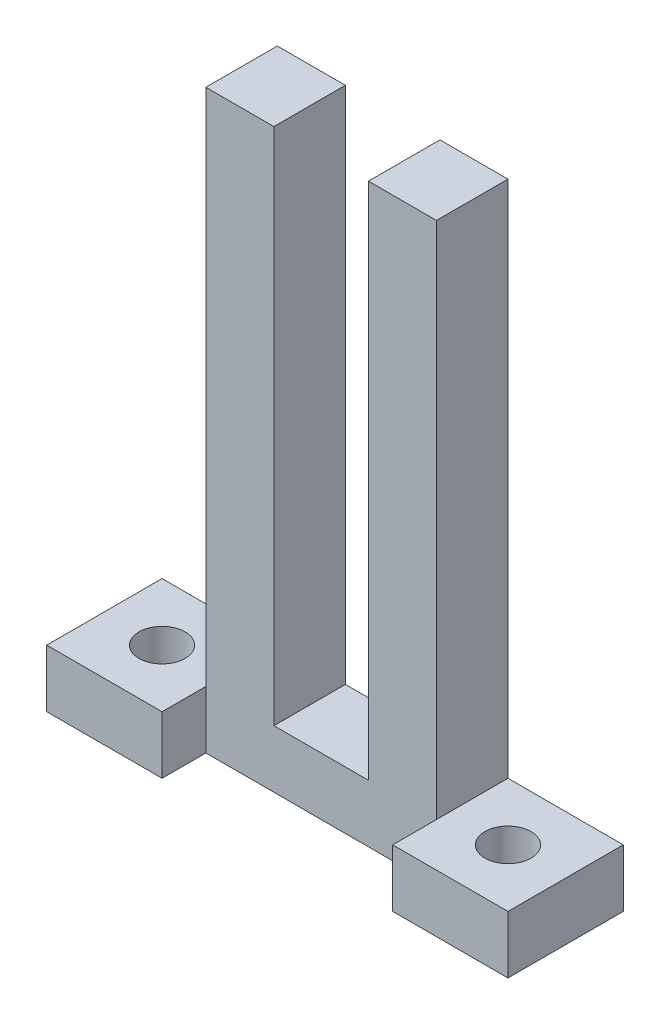
from build123d import *

# Parameters (mm, degrees)
SKETCH_2_W          = 5.9
SKETCH_2_H          = 6.2
EXTRUDE_1_DEPTH     = 50
EXTRUDE_1_2_DEPTH   = 50
SKETCH_3_W          = 40
SKETCH_3_H          = 6.2
EXTRUDE_2_DEPTH     = 5
SKETCH_4_W          = 10
SKETCH_4_H          = 5
EXTRUDE_3_DEPTH     = 3.8
CUT_EXTRUDE_4_REACH = 56.437
SKETCH_5_R          = 2


with BuildPart() as part:
    # Эскиз2 → Вытянуть1 (new body)
    with BuildSketch(Plane(origin=(0, 0, 0), x_dir=(1, 0, 0), z_dir=(0, 1, 0))):
        with Locations((2.95, 3.1)):
            Rectangle(SKETCH_2_W, SKETCH_2_H)
    extrude(amount=EXTRUDE_1_DEPTH)



with BuildPart() as body_2:
    # Эскиз2 → Extrude 1 2 (new body)
    with BuildSketch(Plane(origin=(0, 0, 0), x_dir=(1, 0, 0), z_dir=(0, 1, 0))):
        with Locations((17.05, 3.1)):
            Rectangle(SKETCH_2_W, SKETCH_2_H)
    extrude(amount=EXTRUDE_1_2_DEPTH)


with BuildPart() as part_1:
    add(part.part)

    add(body_2.part)  # Вытянуть2 merges body 2
    # Эскиз3 → Вытянуть2 (add)
    with BuildSketch(Plane(origin=(0, 0, 0), x_dir=(1, 0, 0), z_dir=(0, 1, 0))):
        with Locations((10, 3.1)):
            Rectangle(SKETCH_3_W, SKETCH_3_H)
    extrude(amount=EXTRUDE_2_DEPTH)

    # Эскиз4 → Вытянуть3 (add)
    with BuildSketch(Plane.XY):
        with Locations((-5, 2.5)):
            Rectangle(SKETCH_4_W, SKETCH_4_H)
        with Locations((25, 2.5)):
            Rectangle(SKETCH_4_W, SKETCH_4_H)
    extrude(amount=EXTRUDE_3_DEPTH)

    # Эскиз5 → Вытянуть4 (cut, up to next)
    with BuildSketch(Plane(origin=(0, 5, 0), x_dir=(1, 0, 0), z_dir=(0, 1, 0)), mode=Mode.PRIVATE) as cut_extrude_4_sk1:
        with Locations(Location((25, 1.2, 0), (0, 0, 270))):
            Circle(SKETCH_5_R)
    cut_extrude_4_tool1 = extrude(cut_extrude_4_sk1.sketch, amount=-CUT_EXTRUDE_4_REACH, mode=Mode.PRIVATE) & part_1.part
    # Эскиз5 → Вытянуть4 (cut, up to next)
    with BuildSketch(Plane(origin=(0, 5, 0), x_dir=(1, 0, 0), z_dir=(0, 1, 0)), mode=Mode.PRIVATE) as cut_extrude_4_sk2:
        with Locations(Location((-5, 1.2, 0), (0, 0, 270))):
            Circle(SKETCH_5_R)
    cut_extrude_4_tool2 = extrude(cut_extrude_4_sk2.sketch, amount=-CUT_EXTRUDE_4_REACH, mode=Mode.PRIVATE) & part_1.part
    add(cut_extrude_4_tool1.solids().sort_by_distance((25, 5, -1.2))[0], mode=Mode.SUBTRACT)
    add(cut_extrude_4_tool2.solids().sort_by_distance((-5, 5, -1.2))[0], mode=Mode.SUBTRACT)


solid = part_1.part
